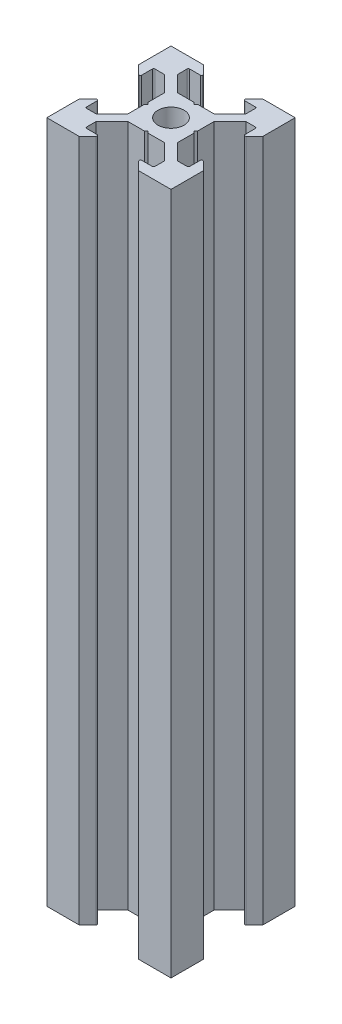
from build123d import *

# Parameters (mm, degrees)
BOSS_EXTRU_1_DEPTH      = 10
BOSS_EXTRU_1_DEPTH_BACK = 10
ESQUISSE1_W             = 20
ESQUISSE1_H             = 110
ESQUISSE2_R             = 2.1
ENL_V_MAT_EXTRU_1_DEPTH = 111.905365064


with BuildPart() as part:
    # Esquisse1 → Boss.-Extru.1 (new, two sides: drawn at the far end of the back side and taken through both)
    with BuildSketch(Plane.XY.offset(-BOSS_EXTRU_1_DEPTH_BACK)):
        Rectangle(ESQUISSE1_W, ESQUISSE1_H)
    extrude(amount=BOSS_EXTRU_1_DEPTH + BOSS_EXTRU_1_DEPTH_BACK)

    # Esquisse2 → Enlèv. mat.-Extru.1 (cut, through all)
    with BuildSketch(Plane(origin=(0, 55, 0), x_dir=(1, 0, 0), z_dir=(0, 1, 0))):
        with BuildLine():
            Line((-3.441421356, -8.641421356), (-4.8, -10))
            Line((-4.8, -10), (4.8, -10))
            Line((4.8, -10), (3.441421356, -8.641421356))
            ThreePointArc((3.441421356, -8.641421356), (3.398066806, -8.423463314), (3.582842712, -8.3))
            Line((3.582842712, -8.3), (5.3, -8.3))
            ThreePointArc((5.3, -8.3), (5.441421356, -8.241421356), (5.5, -8.1))
            Line((5.5, -8.1), (5.5, -6.560660172))
            Line((5.5, -6.560660172), (2.939339828, -4))
            Line((2.939339828, -4), (0.282842712, -4))
            Line((0.282842712, -4), (0, -3.717157288))
            Line((0, -3.717157288), (-0.282842712, -4))
            Line((-0.282842712, -4), (-2.939339828, -4))
            Line((-2.939339828, -4), (-5.5, -6.560660172))
            Line((-5.5, -6.560660172), (-5.5, -8.1))
            ThreePointArc((-5.5, -8.1), (-5.441421356, -8.241421356), (-5.3, -8.3))
            Line((-5.3, -8.3), (-3.582842712, -8.3))
            ThreePointArc((-3.582842712, -8.3), (-3.398066806, -8.423463314), (-3.441421356, -8.641421356))
        make_face()
        with BuildLine():
            Line((-10, 4.8), (-10, -4.8))
            Line((-10, -4.8), (-8.641421356, -3.441421356))
            ThreePointArc((-8.641421356, -3.441421356), (-8.423463314, -3.398066806), (-8.3, -3.582842712))
            Line((-8.3, -3.582842712), (-8.3, -5.3))
            ThreePointArc((-8.3, -5.3), (-8.241421356, -5.441421356), (-8.1, -5.5))
            Line((-8.1, -5.5), (-6.560660172, -5.5))
            Line((-6.560660172, -5.5), (-4, -2.939339828))
            Line((-4, -2.939339828), (-4, -0.282842712))
            Line((-4, -0.282842712), (-3.717157288, 0))
            Line((-3.717157288, 0), (-4, 0.282842712))
            Line((-4, 0.282842712), (-4, 2.939339828))
            Line((-4, 2.939339828), (-6.560660172, 5.5))
            Line((-6.560660172, 5.5), (-8.1, 5.5))
            ThreePointArc((-8.1, 5.5), (-8.241421356, 5.441421356), (-8.3, 5.3))
            Line((-8.3, 5.3), (-8.3, 3.582842712))
            ThreePointArc((-8.3, 3.582842712), (-8.423463314, 3.398066806), (-8.641421356, 3.441421356))
            Line((-8.641421356, 3.441421356), (-10, 4.8))
        make_face()
        with BuildLine():
            Line((8.641421356, -3.441421356), (10, -4.8))
            Line((10, -4.8), (10, 4.8))
            Line((10, 4.8), (8.641421356, 3.441421356))
            ThreePointArc((8.641421356, 3.441421356), (8.423463314, 3.398066806), (8.3, 3.582842712))
            Line((8.3, 3.582842712), (8.3, 5.3))
            ThreePointArc((8.3, 5.3), (8.241421356, 5.441421356), (8.1, 5.5))
            Line((8.1, 5.5), (6.560660172, 5.5))
            Line((6.560660172, 5.5), (4, 2.939339828))
            Line((4, 2.939339828), (4, 0.282842712))
            Line((4, 0.282842712), (3.717157288, 0))
            Line((3.717157288, 0), (4, -0.282842712))
            Line((4, -0.282842712), (4, -2.939339828))
            Line((4, -2.939339828), (6.560660172, -5.5))
            Line((6.560660172, -5.5), (8.1, -5.5))
            ThreePointArc((8.1, -5.5), (8.241421356, -5.441421356), (8.3, -5.3))
            Line((8.3, -5.3), (8.3, -3.582842712))
            ThreePointArc((8.3, -3.582842712), (8.423463314, -3.398066806), (8.641421356, -3.441421356))
        make_face()
        with BuildLine():
            Line((4.8, 10), (-4.8, 10))
            Line((-4.8, 10), (-3.441421356, 8.641421356))
            ThreePointArc((-3.441421356, 8.641421356), (-3.398066806, 8.423463314), (-3.582842712, 8.3))
            Line((-3.582842712, 8.3), (-5.3, 8.3))
            ThreePointArc((-5.3, 8.3), (-5.441421356, 8.241421356), (-5.5, 8.1))
            Line((-5.5, 8.1), (-5.5, 6.560660172))
            Line((-5.5, 6.560660172), (-2.939339828, 4))
            Line((-2.939339828, 4), (-0.282842712, 4))
            Line((-0.282842712, 4), (0, 3.717157288))
            Line((0, 3.717157288), (0.282842712, 4))
            Line((0.282842712, 4), (2.939339828, 4))
            Line((2.939339828, 4), (5.5, 6.560660172))
            Line((5.5, 6.560660172), (5.5, 8.1))
            ThreePointArc((5.5, 8.1), (5.441421356, 8.241421356), (5.3, 8.3))
            Line((5.3, 8.3), (3.582842712, 8.3))
            ThreePointArc((3.582842712, 8.3), (3.398066806, 8.423463314), (3.441421356, 8.641421356))
            Line((3.441421356, 8.641421356), (4.8, 10))
        make_face()
        Circle(ESQUISSE2_R)
    extrude(amount=-ENL_V_MAT_EXTRU_1_DEPTH, mode=Mode.SUBTRACT)


solid = part.part
